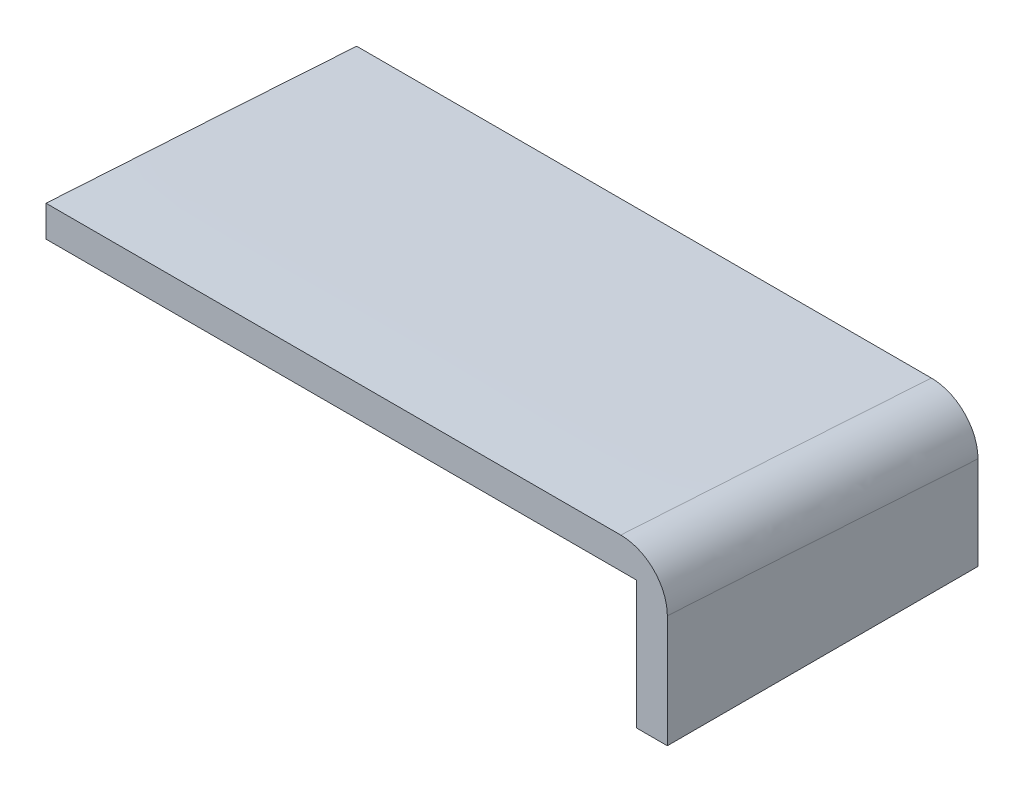
from build123d import *

# Parameters (mm, degrees)
SKETCH_1_W           = 80
SKETCH_1_H           = 100
EXTRUDE_1_DEPTH      = 100
SKETCH_2_W           = 80
SKETCH_2_H           = 85
CUT_EXTRUDE_1_DEPTH  = 90
CUT_EXTRUDE_5_DEPTH  = 138.477270849
SHELL_2_T            = -2
FILLET_1_R           = 3
FILLET_2_R           = 5
FILLET_3_R           = 3
SKETCH_6_W           = 3.8
SKETCH_6_H           = 2.5
CUT_EXTRUDE_6_DEPTH  = 85
SKETCH_8_W           = 5
SKETCH_8_H           = 5
CUT_EXTRUDE_7_DEPTH  = 100
SKETCH_11_W          = 2
SKETCH_11_H          = 1
CUT_EXTRUDE_8_DEPTH  = 119.74342103
SCALE_1_SCALE        = 5
SKETCH_12_W          = 400
SKETCH_12_H          = 300
SKETCH_12_W_2        = 185
SKETCH_12_H_2        = 29.670884313
CUT_EXTRUDE_11_DEPTH = 594.717104512
SKETCH_15_W          = 190
SKETCH_15_H          = 190
SKETCH_15_H_2        = 200
SKETCH_15_W_2        = 10
CUT_EXTRUDE_13_DEPTH = 575.45626481


with BuildPart() as part:
    # 스케치1 → 보스-돌출1 (new body)
    with BuildSketch(Plane.XY):
        Rectangle(SKETCH_1_W, SKETCH_1_H)
    extrude(amount=-EXTRUDE_1_DEPTH)

    # 스케치2 → 컷-돌출1 (cut)
    with BuildSketch(Plane(origin=(40, 0, 0), x_dir=(0, 0, -1), z_dir=(1, 0, 0))):
        with Locations((40, 7.5)):
            Rectangle(SKETCH_2_W, SKETCH_2_H)
    extrude(amount=-CUT_EXTRUDE_1_DEPTH, mode=Mode.SUBTRACT)

    # 스케치5 → 컷-돌출5 (cut, through all)
    with BuildSketch(Plane(origin=(40, 0, 0), x_dir=(0, 0, -1), z_dir=(1, 0, 0))):
        with BuildLine():
            add(Edge.make_bspline(
                [(0, -39.376697629), (18.60893103, -37.813832642), (60.522018707, -41.448787519), (82.629316251, -41.815039561), (94.476954899, -29.981594577), (72.35205171, -11.407179683), (96, 50)],
                knots=[0, 0, 0, 0, 0.361871867, 0.526261735, 0.755385015, 1, 1, 1, 1], degree=3))
            Line((96, 50), (80, 50))
            Line((80, 50), (80, -35))
            Line((80, -35), (0, -35))
            Line((0, -35), (0, -39.376697629))
        make_face()
    extrude(amount=-CUT_EXTRUDE_5_DEPTH, mode=Mode.SUBTRACT)

    # 쉘2
    shell_2_openings = [part.faces().sort_by_distance(p)[0] for p in [
        (0, 0, -100),
        (0, -50, -50),
    ]]
    offset(amount=SHELL_2_T, openings=shell_2_openings, kind=Kind.INTERSECTION)

    # 필렛1
    fillet_1_edges = [part.edges().sort_by_distance(p)[0] for p in [
        (0, 50, -96),
    ]]
    fillet(fillet_1_edges, radius=FILLET_1_R)

    # 필렛2
    fillet_2_edges = [part.edges().sort_by_distance(p)[0] for p in [
        (0, -39.376697629, 0),
    ]]
    fillet(fillet_2_edges, radius=FILLET_2_R)

    # 필렛3
    fillet_3_edges = [part.edges().sort_by_distance(p)[0] for p in [
        (40, -47.032911569, 0),
        (40, 49.469386486, -96.360930071),
        (-40, 49.469386486, -96.360930071),
        (40, -34.292790316, -87.583679146),
        (-40, -34.292790311, -87.583679133),
        (40, -40.61329303, -1.383366779),
        (-40, -47.032911569, 0),
        (-40, -40.61329303, -1.383366779),
        (-40, 50, -99.032247048),
        (40, 50, -99.032247048),
    ]]
    fillet(fillet_3_edges, radius=FILLET_3_R)

    # 스케치6 → 컷-돌출6 (cut)
    with BuildSketch(Plane(origin=(0, 0, -100), x_dir=(-1, 0, 0), z_dir=(0, 0, -1))):
        with Locations((-10, 10)):
            Rectangle(SKETCH_6_W, SKETCH_6_H)
        with Locations((10, 10)):
            Rectangle(SKETCH_6_W, SKETCH_6_H)
    extrude(amount=-CUT_EXTRUDE_6_DEPTH, mode=Mode.SUBTRACT)

    # 스케치8 → 컷-돌출7 (cut)
    with BuildSketch(Plane(origin=(0, 50, 0), x_dir=(1, 0, 0), z_dir=(0, 1, 0))):
        with Locations((-20, 69.358931696)):
            Rectangle(SKETCH_8_W, SKETCH_8_H)
        with Locations((20, 69.358931696)):
            Rectangle(SKETCH_8_W, SKETCH_8_H)
    extrude(amount=-CUT_EXTRUDE_7_DEPTH, mode=Mode.SUBTRACT)

    # 스케치11 → 컷-돌출8 (cut, through all)
    with BuildSketch(Plane(origin=(0, 0, -100), x_dir=(-1, 0, 0), z_dir=(0, 0, -1))):
        with Locations((-10, 3.626900341)):
            Rectangle(SKETCH_11_W, SKETCH_11_H)
        with Locations((10, 3.626900341)):
            Rectangle(SKETCH_11_W, SKETCH_11_H)
    extrude(amount=-CUT_EXTRUDE_8_DEPTH, mode=Mode.SUBTRACT)


with BuildPart() as part_1:
    # 축척1: scaled about (0, 0, 0)
    add(part.part.scale(SCALE_1_SCALE))

    # 스케치12 → 컷-돌출11 (cut, through all)
    with BuildSketch(Plane.XY):
        with Locations((0, 100)):
            Rectangle(SKETCH_12_W, SKETCH_12_H)
        Polygon((0, -50), (-200, -50), (-200, -250), (-185, -250), (-185, -220.329115687), (0, -220.329115687), align=None)
        with Locations((-92.5, -235.164557844)):
            Rectangle(SKETCH_12_W_2, SKETCH_12_H_2)
    extrude(amount=-CUT_EXTRUDE_11_DEPTH, mode=Mode.SUBTRACT)

    # 스케치15 → 컷-돌출13 (cut, through all)
    with BuildSketch(Plane.XZ.offset(250)):
        with Locations((95, -105)):
            Rectangle(SKETCH_15_W, SKETCH_15_H)
        with BuildLine():
            Line((190, -200), (200, -200))
            Line((200, -200), (200, -15))
            ThreePointArc((200, -15), (195.606601718, -4.393398282), (185, 0))
            Line((185, 0), (0, 0))
            Line((0, 0), (0, -10))
            Line((0, -10), (190, -10))
            Line((190, -10), (190, -200))
        make_face()
        with Locations((95, -400)):
            Rectangle(SKETCH_15_W, SKETCH_15_H_2)
        with Locations((195, -400)):
            Rectangle(SKETCH_15_W_2, SKETCH_15_H_2)
    extrude(amount=-CUT_EXTRUDE_13_DEPTH, mode=Mode.SUBTRACT)


solid = part_1.part
